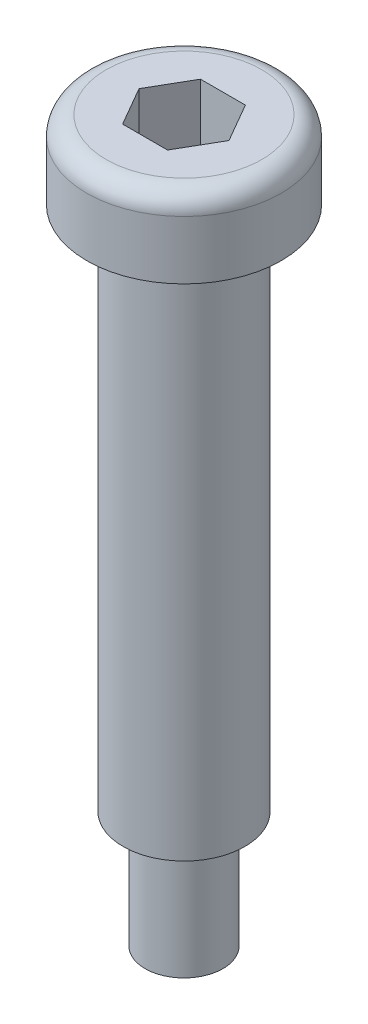
from build123d import *

# Parameters (mm, degrees)
CUT_EXTRUDE1_DEPTH = 3
FILLET1_R          = 1


with BuildPart() as part:
    # Sketch1 → Revolve1 (revolve)
    with BuildSketch(Plane.XY):
        Polygon((0, 0), (-2, 0), (-2, 6), (-3.13, 6), (-3.13, 33), (-5, 33), (-5, 37), (0, 37), align=None)
    revolve(axis=Axis((0, 37, 0), (0, -1, 0)))

    # Sketch2 → Cut-Extrude1 (cut)
    with BuildSketch(Plane(origin=(0, 37, 0), x_dir=(1, 0, 0), z_dir=(0, 1, 0))):
        Polygon((-1.154700538, -2), (1.154700538, -2), (2.309401077, 0), (1.154700538, 2), (-1.154700538, 2), (-2.309401077, 0), align=None)
    extrude(amount=-CUT_EXTRUDE1_DEPTH, mode=Mode.SUBTRACT)

    # Fillet1
    fillet1_edges = [part.edges().sort_by_distance(p)[0] for p in [
        (5, 37, 0),
    ]]
    fillet(fillet1_edges, radius=FILLET1_R)


solid = part.part
